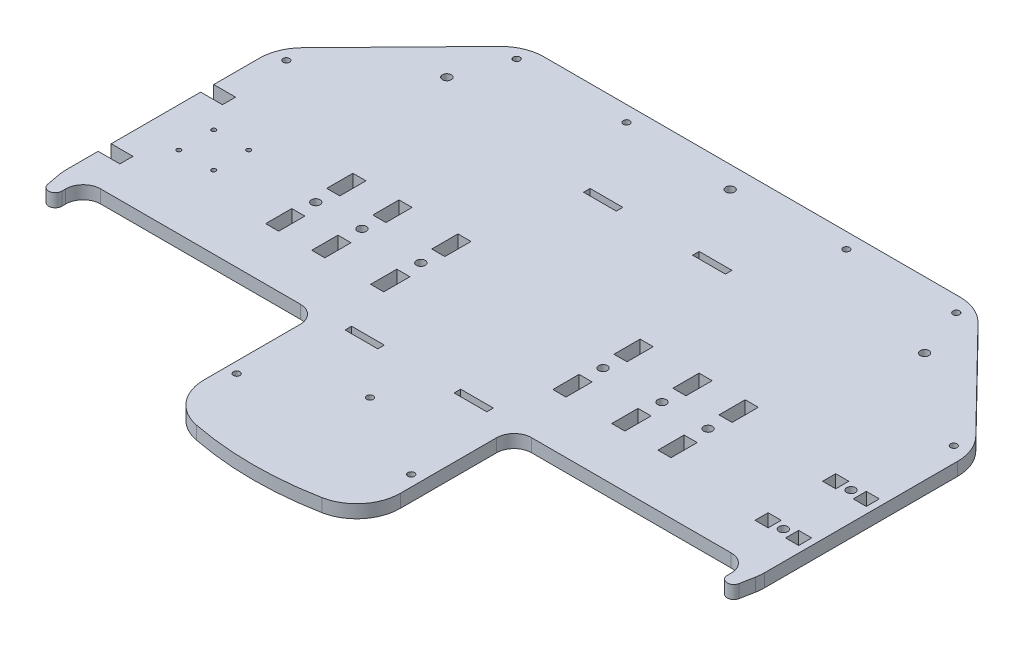
from build123d import *

# Parameters (mm, degrees)
BOSS_EXTRU_1_DEPTH       = 6
ESQUISSE4_W              = 107.5
ESQUISSE4_H              = 70
ENL_V_MAT_EXTRU_3_DEPTH  = 6
CONG_1_R                 = 20
CONG_2_R                 = 8
CONG_3_R                 = 3
ESQUISSE7_W              = 15
ESQUISSE7_H              = 3
ENL_V_MAT_EXTRU_6_DEPTH  = 10
ESQUISSE6_R              = 2
ENL_V_MAT_EXTRU_5_DEPTH  = 10
ESQUISSE8_R              = 2
ESQUISSE8_W              = 6
ESQUISSE8_H              = 12
ENL_V_MAT_EXTRU_7_DEPTH  = 10
ESQUISSE9_R              = 2
ESQUISSE9_W              = 6
ESQUISSE9_H              = 6
ENL_V_MAT_EXTRU_8_DEPTH  = 10
ESQUISSE10_W             = 15
ESQUISSE10_H             = 3
ENL_V_MAT_EXTRU_9_DEPTH  = 10
ESQUISSE11_R             = 1.5
ESQUISSE11_R_2           = 2
ESQUISSE11_R_3           = 1
ESQUISSE11_W             = 10
ESQUISSE11_H             = 6
ENL_V_MAT_EXTRU_10_DEPTH = 10


with BuildPart() as part:
    # Esquisse1 → Boss.-Extru.1 (new body)
    with BuildSketch(Plane(origin=(0, 0, 0), x_dir=(1, 0, 0), z_dir=(0, 1, 0))):
        with BuildLine():
            Line((-159.651418776, 61.996478628), (-151.00295557, 16.28223991))
            ThreePointArc((-151.00295557, 16.28223991), (-144.111724845, 4.599428553), (-131.351536794, 0))
            Line((-131.351536794, 0), (-50.176822125, 0))
            ThreePointArc((-50.176822125, 0), (0, -8.568957982), (50.176822125, 0))
            Line((50.176822125, 0), (131.351536794, 0))
            ThreePointArc((131.351536794, 0), (144.111724845, 4.599428553), (151.00295557, 16.28223991))
            Line((151.00295557, 16.28223991), (159.651418776, 61.996478628))
            ThreePointArc((159.651418776, 61.996478628), (159.912664005, 63.847205713), (160, 65.714238717))
            Line((160, 65.714238717), (160, 154.285761283))
            ThreePointArc((160, 154.285761283), (158.521020838, 161.833727042), (154.30282129, 168.265364394))
            Line((154.30282129, 168.265364394), (109.621642599, 213.979603112))
            ThreePointArc((109.621642599, 213.979603112), (103.077942966, 218.433557202), (95.31882131, 220))
            Line((95.31882131, 220), (-95.31882131, 220))
            ThreePointArc((-95.31882131, 220), (-103.077942966, 218.433557202), (-109.621642599, 213.979603112))
            Line((-109.621642599, 213.979603112), (-154.30282129, 168.265364394))
            ThreePointArc((-154.30282129, 168.265364394), (-158.521020838, 161.833727042), (-160, 154.285761283))
            Line((-160, 154.285761283), (-160, 65.714238717))
            ThreePointArc((-160, 65.714238717), (-159.912664005, 63.847205713), (-159.651418776, 61.996478628))
        make_face()
    extrude(amount=BOSS_EXTRU_1_DEPTH)

    # Esquisse4 → Enlèv. mat.-Extru.3 (cut)
    with BuildSketch(Plane(origin=(0, 6, 0), x_dir=(1, 0, 0), z_dir=(0, 1, 0))):
        with Locations((-98.75, 31)):
            Rectangle(ESQUISSE4_W, ESQUISSE4_H)
        with Locations((98.75, 31)):
            Rectangle(ESQUISSE4_W, ESQUISSE4_H)
    extrude(amount=-ENL_V_MAT_EXTRU_3_DEPTH, mode=Mode.SUBTRACT)

    # Congé1
    cong_1_edges = [part.edges().sort_by_distance(p)[0] for p in [
        (-45, 3, 1.716975434),
        (45, 3, 1.716975434),
    ]]
    fillet(cong_1_edges, radius=CONG_1_R)

    # Congé2
    cong_2_edges = [part.edges().sort_by_distance(p)[0] for p in [
        (-45, 3, -66),
        (-152.5, 3, -66),
        (152.5, 3, -66),
        (45, 3, -66),
    ]]
    fillet(cong_2_edges, radius=CONG_2_R)

    # Congé3
    cong_3_edges = [part.edges().sort_by_distance(p)[0] for p in [
        (-152.5, 3, -24.195350576),
        (152.5, 3, -24.195350576),
    ]]
    fillet(cong_3_edges, radius=CONG_3_R)

    # Esquisse7 → Enlèv. mat.-Extru.6 (cut)
    with BuildSketch(Plane(origin=(0, 6, 0), x_dir=(1, 0, 0), z_dir=(0, 1, 0))):
        with Locations((-25, 67.499999998)):
            Rectangle(ESQUISSE7_W, ESQUISSE7_H)
        with Locations((25, 67.499999998)):
            Rectangle(ESQUISSE7_W, ESQUISSE7_H)
    extrude(amount=-ENL_V_MAT_EXTRU_6_DEPTH, mode=Mode.SUBTRACT)

    # Esquisse6 → Enlèv. mat.-Extru.5 (cut)
    with BuildSketch(Plane(origin=(0, 6, 0), x_dir=(1, 0, 0), z_dir=(0, 1, 0))):
        with Locations(Location((0, 210, 0), (0, 0, 270))):
            Circle(ESQUISSE6_R)
    extrude(amount=-ENL_V_MAT_EXTRU_5_DEPTH, mode=Mode.SUBTRACT)

    # Esquisse8 → Enlèv. mat.-Extru.7 (cut)
    with BuildSketch(Plane(origin=(0, 6, 0), x_dir=(1, 0, 0), z_dir=(0, 1, 0))):
        with Locations(Location((-89.9, 110, 0), (0, 0, 270))):
            Circle(ESQUISSE8_R)
        with Locations(Location((-68.76, 110, 0), (0, 0, 270))):
            Circle(ESQUISSE8_R)
        with Locations(Location((-41.76, 110, 0), (0, 0, 270))):
            Circle(ESQUISSE8_R)
        with Locations(Location((41.76, 110, 0), (0, 0, 270))):
            Circle(ESQUISSE8_R)
        with Locations(Location((68.76, 110, 0), (0, 0, 270))):
            Circle(ESQUISSE8_R)
        with Locations(Location((89.9, 110, 0), (0, 0, 270))):
            Circle(ESQUISSE8_R)
        with Locations((-89.9, 96)):
            Rectangle(ESQUISSE8_W, ESQUISSE8_H)
        with Locations((-89.9, 124)):
            Rectangle(ESQUISSE8_W, ESQUISSE8_H)
        with Locations((-68.76, 96)):
            Rectangle(ESQUISSE8_W, ESQUISSE8_H)
        with Locations((-68.76, 124)):
            Rectangle(ESQUISSE8_W, ESQUISSE8_H)
        with Locations((-41.76, 96)):
            Rectangle(ESQUISSE8_W, ESQUISSE8_H)
        with Locations((-41.76, 124)):
            Rectangle(ESQUISSE8_W, ESQUISSE8_H)
        with Locations((41.76, 96)):
            Rectangle(ESQUISSE8_W, ESQUISSE8_H)
        with Locations((41.76, 124)):
            Rectangle(ESQUISSE8_W, ESQUISSE8_H)
        with Locations((68.76, 96)):
            Rectangle(ESQUISSE8_W, ESQUISSE8_H)
        with Locations((68.76, 124)):
            Rectangle(ESQUISSE8_W, ESQUISSE8_H)
        with Locations((89.9, 96)):
            Rectangle(ESQUISSE8_W, ESQUISSE8_H)
        with Locations((89.9, 124)):
            Rectangle(ESQUISSE8_W, ESQUISSE8_H)
    extrude(amount=-ENL_V_MAT_EXTRU_7_DEPTH, mode=Mode.SUBTRACT)

    # Esquisse9 → Enlèv. mat.-Extru.8 (cut)
    with BuildSketch(Plane(origin=(0, 6, 0), x_dir=(1, 0, 0), z_dir=(0, 1, 0))):
        with Locations(Location((147, 118.4, 0), (0, 0, 270))):
            Circle(ESQUISSE9_R)
        with Locations(Location((147, 87.4, 0), (0, 0, 270))):
            Circle(ESQUISSE9_R)
        with Locations((154, 118.4)):
            Rectangle(ESQUISSE9_W, ESQUISSE9_H)
        with Locations((154, 87.4)):
            Rectangle(ESQUISSE9_W, ESQUISSE9_H)
        with Locations((140, 118.4)):
            Rectangle(ESQUISSE9_W, ESQUISSE9_H)
        with Locations((140, 87.4)):
            Rectangle(ESQUISSE9_W, ESQUISSE9_H)
    extrude(amount=-ENL_V_MAT_EXTRU_8_DEPTH, mode=Mode.SUBTRACT)

    # Esquisse10 → Enlèv. mat.-Extru.9 (cut)
    with BuildSketch(Plane(origin=(0, 6, 0), x_dir=(1, 0, 0), z_dir=(0, 1, 0))):
        with Locations((-25, 176.83)):
            Rectangle(ESQUISSE10_W, ESQUISSE10_H)
        with Locations((25, 176.83)):
            Rectangle(ESQUISSE10_W, ESQUISSE10_H)
    extrude(amount=-ENL_V_MAT_EXTRU_9_DEPTH, mode=Mode.SUBTRACT)

    # Esquisse11 → Enlèv. mat.-Extru.10 (cut)
    with BuildSketch(Plane(origin=(0, 6, 0), x_dir=(-1, 0, 0), z_dir=(0, 1, 0))):
        with Locations(Location((40, -23.835046453, 0), (0, 0, 90))):
            Circle(ESQUISSE11_R)
        with Locations(Location((-40, -23.835046453, 0), (0, 0, 90))):
            Circle(ESQUISSE11_R)
        with Locations(Location((100.750206469, -212.903490041, 0), (0, 0, 90))):
            Circle(ESQUISSE11_R)
        with Locations(Location((152.964714587, -159.569337314, 0), (0, 0, 90))):
            Circle(ESQUISSE11_R)
        with Locations(Location((50.375103235, -212.903490041, 0), (0, 0, 90))):
            Circle(ESQUISSE11_R)
        with Locations(Location((-152.964714587, -159.569337314, 0), (0, 0, 90))):
            Circle(ESQUISSE11_R)
        with Locations(Location((-100.750206469, -212.903490041, 0), (0, 0, 90))):
            Circle(ESQUISSE11_R)
        with Locations(Location((-50.375103235, -212.903490041, 0), (0, 0, 90))):
            Circle(ESQUISSE11_R)
        with Locations(Location((0, -44.911042018, 0), (0, 0, 90))):
            Circle(ESQUISSE11_R)
        with Locations(Location((-109.47882131, -189.64, 0), (0, 0, 90))):
            Circle(ESQUISSE11_R_2)
        with Locations(Location((109.47882131, -189.64, 0), (0, 0, 90))):
            Circle(ESQUISSE11_R_2)
        with Locations(Location((142, -99.324238717, 0), (0, 0, 90))):
            Circle(ESQUISSE11_R_3)
        with Locations(Location((126, -99.324238717, 0), (0, 0, 90))):
            Circle(ESQUISSE11_R_3)
        with Locations(Location((126, -115.324238717, 0), (0, 0, 90))):
            Circle(ESQUISSE11_R_3)
        with Locations(Location((142, -115.324238717, 0), (0, 0, 90))):
            Circle(ESQUISSE11_R_3)
        with Locations((155, -130.324238717)):
            Rectangle(ESQUISSE11_W, ESQUISSE11_H)
        with Locations((155, -83.324238717)):
            Rectangle(ESQUISSE11_W, ESQUISSE11_H)
    extrude(amount=-ENL_V_MAT_EXTRU_10_DEPTH, mode=Mode.SUBTRACT)


solid = part.part
